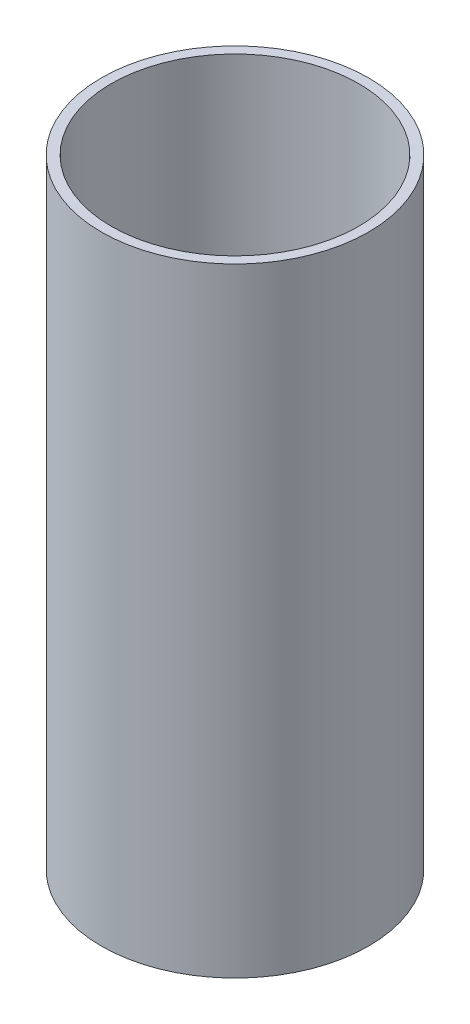
from build123d import *

# Parameters (mm, degrees)
SKETCH2_R           = 13.716
SKETCH2_R_2         = 12.7
BOSS_EXTRUDE1_DEPTH = 63.5


with BuildPart() as part:
    # Sketch2 → Boss-Extrude1 (new body)
    with BuildSketch(Plane(origin=(0, 0, 0), x_dir=(1, 0, 0), z_dir=(0, 1, 0))):
        with Locations(Location((0, 0, 0), (0, 0, 270))):
            Circle(SKETCH2_R)
        with Locations(Location((0, 0, 0), (0, 0, 270))):
            Circle(SKETCH2_R_2, mode=Mode.SUBTRACT)
    extrude(amount=BOSS_EXTRUDE1_DEPTH)


solid = part.part
